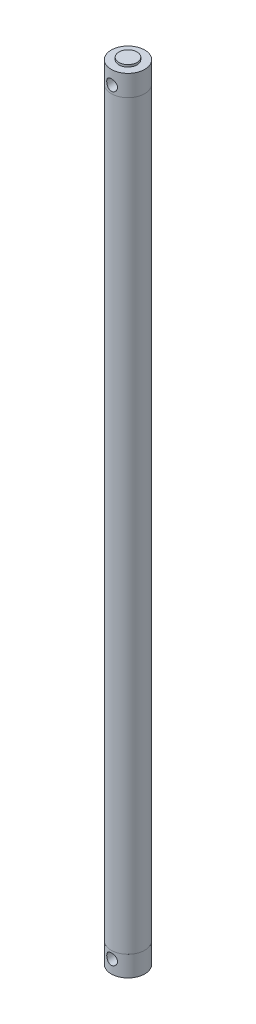
from build123d import *

# Parameters (mm, degrees)
SKETCH_1_R          = 15.5
SKETCH_1_R_2        = 12.5
EXTRUDE_1_DEPTH     = 686
SKETCH_2_R          = 15.5
EXTRUDE_2_DEPTH     = 19.5
SKETCH_3_R          = 8.375998957
EXTRUDE_3_DEPTH     = 2
SKETCH_4_R          = 15.5
EXTRUDE_4_DEPTH     = 19
SKETCH_5_R          = 7
EXTRUDE_5_DEPTH     = 1.5
SKETCH_6_R          = 5
CUT_EXTRUDE_6_DEPTH = 20.5
SKETCH_7_R          = 5
CUT_EXTRUDE_7_DEPTH = 15
SKETCH_8_R          = 2.1
CUT_EXTRUDE_8_DEPTH = 15


with BuildPart() as part:
    # 草图1 → 拉伸1 (new body)
    with BuildSketch(Plane(origin=(0, 0, 0), x_dir=(1, 0, 0), z_dir=(0, 1, 0))):
        with Locations(Location((0, 0, 0), (0, 0, 270))):
            Circle(SKETCH_1_R)
        with Locations(Location((0, 0, 0), (0, 0, 270))):
            Circle(SKETCH_1_R_2, mode=Mode.SUBTRACT)
    extrude(amount=EXTRUDE_1_DEPTH)


with BuildPart() as body_2:
    # 草图2 → 拉伸2 (new body)
    with BuildSketch(Plane(origin=(0, 686, 0), x_dir=(1, 0, 0), z_dir=(0, 1, 0))):
        with Locations(Location((0, 0, 0), (0, 0, 270))):
            Circle(SKETCH_2_R)
    extrude(amount=EXTRUDE_2_DEPTH)

    # 草图3 → 拉伸3 (add)
    with BuildSketch(Plane(origin=(0, 705.5, 0), x_dir=(1, 0, 0), z_dir=(0, 1, 0))):
        with Locations(Location((0, 0, 0), (0, 0, 270))):
            Circle(SKETCH_3_R)
    extrude(amount=EXTRUDE_3_DEPTH)


with BuildPart() as body_3:
    # 草图4 → 拉伸4 (new body)
    with BuildSketch(Plane.XZ):
        with Locations(Location((0, 0, 0), (0, 0, 270))):
            Circle(SKETCH_4_R)
    extrude(amount=EXTRUDE_4_DEPTH)

    # 草图5 → 拉伸5 (add)
    with BuildSketch(Plane.XZ.offset(19)):
        with Locations(Location((0, 0, 0), (0, 0, 270))):
            Circle(SKETCH_5_R)
    extrude(amount=EXTRUDE_5_DEPTH)

    # 草图6 → 拉伸6 (cut)
    with BuildSketch(Plane.XZ.offset(20.5)):
        with Locations(Location((0, 0, 0), (0, 0, 270))):
            Circle(SKETCH_6_R)
    extrude(amount=-CUT_EXTRUDE_6_DEPTH, mode=Mode.SUBTRACT)


with BuildPart() as cut_extrude_7_tool:
    # 草图7 → 拉伸7 (new body)
    with BuildSketch(Plane.XY.offset(15.5)):
        with Locations(Location((0, -7, 0), (0, 0, 354.260829523))):
            Circle(SKETCH_7_R)
        with Locations((0, 693)):
            Circle(SKETCH_7_R)
    extrude(amount=-CUT_EXTRUDE_7_DEPTH)


with BuildPart() as body_2_1:
    add(body_2.part)

    # 拉伸7: cut by cut_extrude_7_tool
    add(cut_extrude_7_tool.part, mode=Mode.SUBTRACT)


with BuildPart() as body_3_1:
    add(body_3.part)

    # 拉伸7: cut by cut_extrude_7_tool
    add(cut_extrude_7_tool.part, mode=Mode.SUBTRACT)

    # 草图8 → 拉伸8 (cut)
    with BuildSketch(Plane.XZ.offset(19)):
        with Locations(Location((-8.25, 8.25, 0), (0, 0, 270))):
            Circle(SKETCH_8_R)
        with Locations(Location((8.25, 8.25, 0), (0, 0, 270))):
            Circle(SKETCH_8_R)
        with Locations(Location((8.25, -8.25, 0), (0, 0, 270))):
            Circle(SKETCH_8_R)
        with Locations(Location((-8.25, -8.25, 0), (0, 0, 270))):
            Circle(SKETCH_8_R)
    extrude(amount=-CUT_EXTRUDE_8_DEPTH, mode=Mode.SUBTRACT)


solid = Compound([part.part, body_2_1.part, body_3_1.part])
